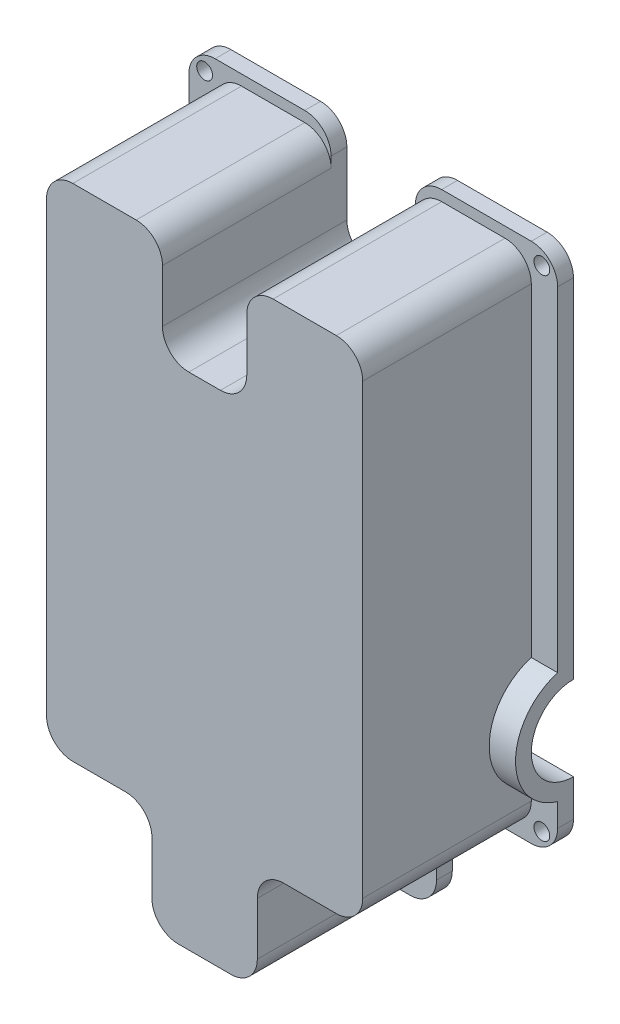
from build123d import *

# Parameters (mm, degrees)
SKETCH1_W           = 70
SKETCH1_H           = 119
BOSS_EXTRUDE1_DEPTH = 35
SKETCH2_R           = 8
CUT_EXTRUDE1_DEPTH  = 8
SKETCH3_R           = 8
CUT_EXTRUDE2_DEPTH  = 8
SKETCH4_W           = 14
SKETCH4_H           = 89
CUT_EXTRUDE3_DEPTH  = 32
CUT_EXTRUDE4_REACH  = 82.804
CUT_EXTRUDE5_REACH  = 82.804
SKETCH7_W           = 23
SKETCH7_H           = 20
SKETCH7_W_2         = 16
CUT_EXTRUDE7_DEPTH  = 78.396705356
CUT_EXTRUDE8_DEPTH  = 5
SKETCH12_W          = 18
SKETCH12_H          = 32
CUT_EXTRUDE9_DEPTH  = 2
SKETCH13_W          = 24
SKETCH13_H          = 32
CUT_EXTRUDE10_DEPTH = 2
SKETCH14_W          = 23
SKETCH14_H          = 32
CUT_EXTRUDE11_DEPTH = 2
SKETCH15_W          = 32
SKETCH15_H          = 20
CUT_EXTRUDE12_DEPTH = 2
SKETCH16_W          = 32
SKETCH16_H          = 20
CUT_EXTRUDE13_DEPTH = 2
SKETCH17_W          = 65
SKETCH17_H          = 32
CUT_EXTRUDE15_DEPTH = 2
SKETCH18_W          = 16
SKETCH18_H          = 32
CUT_EXTRUDE16_DEPTH = 2
CUT_EXTRUDE17_DEPTH = 5
SKETCH21_R          = 1.5
CUT_EXTRUDE18_DEPTH = 10
FILLET1_R           = 5
FILLET2_R           = 5


with BuildPart() as part:
    # Sketch1 → Boss-Extrude1 (new body)
    with BuildSketch(Plane.XY):
        Rectangle(SKETCH1_W, SKETCH1_H)
    extrude(amount=BOSS_EXTRUDE1_DEPTH)

    # Sketch2 → Cut-Extrude1 (cut)
    with BuildSketch(Plane(origin=(35, 0, 0), x_dir=(0, 0, -1), z_dir=(1, 0, 0))):
        with Locations((0, -19.5)):
            Circle(SKETCH2_R)
    extrude(amount=-CUT_EXTRUDE1_DEPTH, mode=Mode.SUBTRACT)

    # Sketch3 → Cut-Extrude2 (cut)
    with BuildSketch(Plane.ZY.offset(35)):
        with Locations((0, 19.5)):
            Circle(SKETCH3_R)
    extrude(amount=-CUT_EXTRUDE2_DEPTH, mode=Mode.SUBTRACT)

    # Sketch4 → Cut-Extrude3 (cut)
    with BuildSketch(Plane(origin=(0, 0, 0), x_dir=(-1, 0, 0), z_dir=(0, 0, -1))):
        Polygon((-13, -34.5), (-13, 54.5), (-27, 54.5), (-27, -11.5), (-27, -27.5), (-27, -34.5), align=None)
        with Locations((0, -10)):
            Rectangle(SKETCH4_W, SKETCH4_H)
        Polygon((27, 54.5), (13, 54.5), (13, -34.5), (27, -34.5), (27, 11.5), (27, 27.5), align=None)
    extrude(amount=-CUT_EXTRUDE3_DEPTH, mode=Mode.SUBTRACT)

    # Sketch5 → Cut-Extrude4 (cut, up to next)
    with BuildSketch(Plane.ZY.offset(-7), mode=Mode.PRIVATE) as cut_extrude4_sk1:
        with BuildLine():
            Line((0, 27.5), (0, 11.5))
            ThreePointArc((0, 11.5), (8, 19.5), (0, 27.5))
        make_face()
    cut_extrude4_tool1 = extrude(cut_extrude4_sk1.sketch, amount=-CUT_EXTRUDE4_REACH, mode=Mode.PRIVATE) & part.part
    add(cut_extrude4_tool1.solids().sort_by_distance((7, 19.5, 3.395305))[0], mode=Mode.SUBTRACT)

    # Sketch6 → Cut-Extrude5 (cut, up to next)
    with BuildSketch(Plane(origin=(-7, 0, 0), x_dir=(0, 0, -1), z_dir=(1, 0, 0)), mode=Mode.PRIVATE) as cut_extrude5_sk1:
        with BuildLine():
            Line((0, -11.5), (0, -27.5))
            ThreePointArc((0, -27.5), (-8, -19.5), (0, -11.5))
        make_face()
    cut_extrude5_tool1 = extrude(cut_extrude5_sk1.sketch, amount=-CUT_EXTRUDE5_REACH, mode=Mode.PRIVATE) & part.part
    add(cut_extrude5_tool1.solids().sort_by_distance((-7, -19.5, 3.395305))[0], mode=Mode.SUBTRACT)

    # Sketch7 → Cut-Extrude7 (cut, through all)
    with BuildSketch(Plane(origin=(0, 0, 0), x_dir=(-1, 0, 0), z_dir=(0, 0, -1))):
        with Locations((23.5, -49.5)):
            Rectangle(SKETCH7_W, SKETCH7_H)
        with Locations((0, 49.5)):
            Rectangle(SKETCH7_W_2, SKETCH7_H)
        with Locations((-23.5, -49.5)):
            Rectangle(SKETCH7_W, SKETCH7_H)
    extrude(amount=-CUT_EXTRUDE7_DEPTH, mode=Mode.SUBTRACT)

    # Sketch11 → Cut-Extrude8 (cut)
    with BuildSketch(Plane(origin=(35, 0, 0), x_dir=(0, 0, -1), z_dir=(1, 0, 0))):
        with BuildLine():
            Line((-3, 59.5), (-35, 59.5))
            Line((-35, 59.5), (-35, -39.5))
            Line((-35, -39.5), (-3, -39.5))
            Line((-3, -39.5), (-3, -30.083005244))
            ThreePointArc((-3, -30.083005244), (-11, -19.5), (-3, -8.916994756))
            Line((-3, -8.916994756), (-3, 59.5))
        make_face()
    extrude(amount=-CUT_EXTRUDE8_DEPTH, mode=Mode.SUBTRACT)

    # Sketch12 → Cut-Extrude9 (cut)
    with BuildSketch(Plane.XZ.offset(39.5)):
        with Locations((21, 19)):
            Rectangle(SKETCH12_W, SKETCH12_H)
    extrude(amount=-CUT_EXTRUDE9_DEPTH, mode=Mode.SUBTRACT)

    # Sketch13 → Cut-Extrude10 (cut)
    with BuildSketch(Plane.XZ.offset(59.5)):
        with Locations((0, 19)):
            Rectangle(SKETCH13_W, SKETCH13_H)
    extrude(amount=-CUT_EXTRUDE10_DEPTH, mode=Mode.SUBTRACT)

    # Sketch14 → Cut-Extrude11 (cut)
    with BuildSketch(Plane.XZ.offset(39.5)):
        with Locations((-23.5, 19)):
            Rectangle(SKETCH14_W, SKETCH14_H)
    extrude(amount=-CUT_EXTRUDE11_DEPTH, mode=Mode.SUBTRACT)

    # Sketch15 → Cut-Extrude12 (cut)
    with BuildSketch(Plane.ZY.offset(12)):
        with Locations((19, -47.5)):
            Rectangle(SKETCH15_W, SKETCH15_H)
    extrude(amount=-CUT_EXTRUDE12_DEPTH, mode=Mode.SUBTRACT)

    # Sketch16 → Cut-Extrude13 (cut)
    with BuildSketch(Plane(origin=(12, 0, 0), x_dir=(0, 0, -1), z_dir=(1, 0, 0))):
        with Locations((-19, -47.5)):
            Rectangle(SKETCH16_W, SKETCH16_H)
    extrude(amount=-CUT_EXTRUDE13_DEPTH, mode=Mode.SUBTRACT)

    # Sketch17 → Cut-Extrude15 (cut)
    with BuildSketch(Plane(origin=(0, 59.5, 0), x_dir=(1, 0, 0), z_dir=(0, 1, 0))):
        with Locations((-2.5, -19)):
            Rectangle(SKETCH17_W, SKETCH17_H)
    extrude(amount=-CUT_EXTRUDE15_DEPTH, mode=Mode.SUBTRACT)

    # Sketch18 → Cut-Extrude16 (cut)
    with BuildSketch(Plane(origin=(0, 39.5, 0), x_dir=(1, 0, 0), z_dir=(0, 1, 0))):
        with Locations((0, -19)):
            Rectangle(SKETCH18_W, SKETCH18_H)
    extrude(amount=-CUT_EXTRUDE16_DEPTH, mode=Mode.SUBTRACT)

    # Sketch19 → Cut-Extrude17 (cut)
    with BuildSketch(Plane.ZY.offset(35)):
        with BuildLine():
            Line((3, 57.5), (35, 57.5))
            Line((35, 57.5), (35, -37.5))
            Line((35, -37.5), (3, -37.5))
            Line((3, -37.5), (3, 8.916994756))
            ThreePointArc((3, 8.916994756), (11, 19.5), (3, 30.083005244))
            Line((3, 30.083005244), (3, 57.5))
        make_face()
    extrude(amount=-CUT_EXTRUDE17_DEPTH, mode=Mode.SUBTRACT)

    # Sketch21 → Cut-Extrude18 (cut)
    with BuildSketch(Plane(origin=(0, 0, 0), x_dir=(-1, 0, 0), z_dir=(0, 0, -1))):
        with Locations((-32, 56.5)):
            Circle(SKETCH21_R)
        with Locations((32, 56.5)):
            Circle(SKETCH21_R)
        with Locations((-32, -36.5)):
            Circle(SKETCH21_R)
        with Locations((32, -36.5)):
            Circle(SKETCH21_R)
    extrude(amount=-CUT_EXTRUDE18_DEPTH, mode=Mode.SUBTRACT)

    # Fillet1
    fillet1_edges = [part.edges().sort_by_distance(p)[0] for p in [
        (-30, 57.5, 19),
        (-8, 57.5, 19),
        (-8, 37.5, 19),
        (8, 37.5, 19),
        (8, 57.5, 19),
        (30, 57.5, 19),
        (30, -37.5, 19),
        (10, -37.5, 19),
        (10, -57.5, 19),
        (-10, -37.5, 19),
        (-30, -37.5, 19),
        (-10, -57.5, 19),
    ]]
    fillet(fillet1_edges, radius=FILLET1_R)

    # Fillet2
    fillet2_edges = [part.edges().sort_by_distance(p)[0] for p in [
        (35, -39.5, 1.5),
        (35, 59.5, 1.5),
        (12, -39.5, 1.5),
        (12, -59.5, 1.5),
        (-12, -59.5, 1.5),
        (-12, -39.5, 1.5),
        (-35, -39.5, 1.5),
        (-8, 59.5, 1.5),
        (8, 59.5, 1.5),
        (-35, 59.5, 1.5),
    ]]
    fillet(fillet2_edges, radius=FILLET2_R)


solid = part.part
